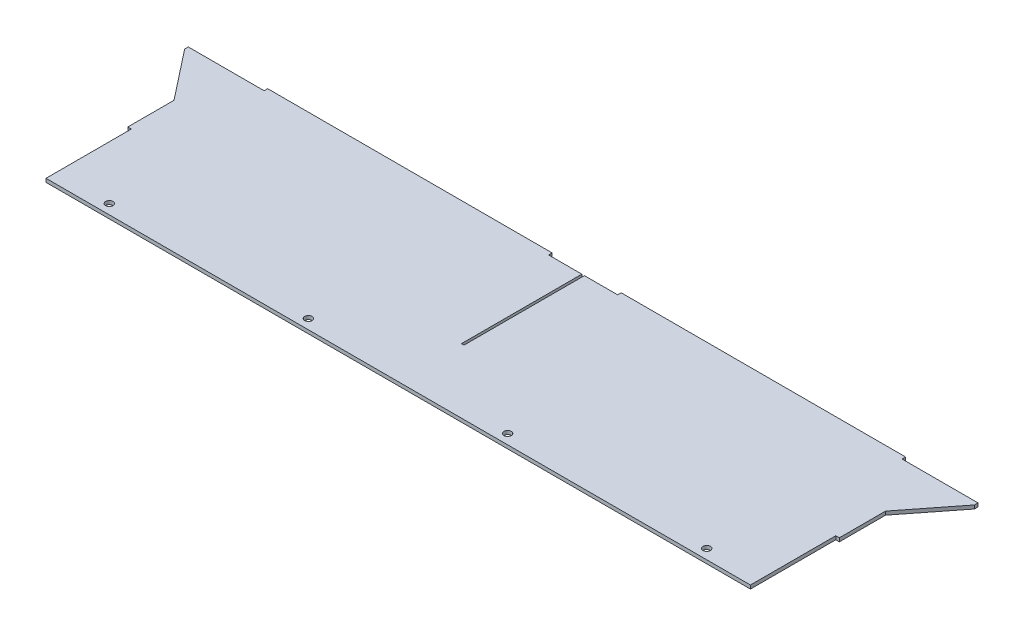
from build123d import *

# Parameters (mm, degrees)
SKETCH1_W            = 635.3556
SKETCH1_H            = 165.1
BOSS_EXTRUDE1_DEPTH  = 1.5875
SKETCH2_W            = 254
SKETCH2_H            = 3.175
BOSS_EXTRUDE2_DEPTH  = 3.175
BOSS_EXTRUDE3_DEPTH  = 3.175
SKETCH5_W            = 1.143
SKETCH5_H            = 107.442
SKETCH5_W_2          = 3.175
SKETCH5_H_2          = 76.2
CUT_EXTRUDE2_DEPTH   = 363.887848815
M6_CLEARANCE_HOLE1_D = 6.6
LPATTERN2_COUNT      = 4
LPATTERN2_PITCH      = 177.8


with BuildPart() as part:
    # Sketch1 → Boss-Extrude1 (new, symmetric)
    with BuildSketch(Plane(origin=(0, 0, 0), x_dir=(1, 0, 0), z_dir=(0, 1, 0))):
        Rectangle(SKETCH1_W, SKETCH1_H)
    extrude(amount=BOSS_EXTRUDE1_DEPTH, both=True)

    # Sketch2 → Boss-Extrude2 (add)
    with BuildSketch(Plane(origin=(0, 0, -82.55), x_dir=(-1, 0, 0), z_dir=(0, 0, -1))):
        with Locations((-157.8229, 0)):
            Rectangle(SKETCH2_W, SKETCH2_H)
        with Locations((157.8229, 0)):
            Rectangle(SKETCH2_W, SKETCH2_H)
    extrude(amount=BOSS_EXTRUDE2_DEPTH)

    # Sketch3 → Boss-Extrude3 (add)
    with BuildSketch(Plane.XZ.offset(1.5875)):
        Polygon((317.6778, -82.55), (352.6028, -82.55), (352.6028, -79.375), (317.6778, -34.925), align=None)
    boss_extrude3 = extrude(amount=-BOSS_EXTRUDE3_DEPTH)

    # Mirror1: Boss-Extrude3 across plane
    add(boss_extrude3.mirror(Plane(origin=(0, 0, 0), x_dir=(0, 0, 1), z_dir=(1, 0, 0))))

    # Sketch5 → Cut-Extrude2 (cut, through all)
    with BuildSketch(Plane.XZ.offset(1.5875)):
        with Locations((0.5715, -28.829)):
            Rectangle(SKETCH5_W, SKETCH5_H)
        with Locations((-0.5715, -28.829)):
            Rectangle(SKETCH5_W, SKETCH5_H)
        with Locations((-316.0903, 44.45)):
            Rectangle(SKETCH5_W_2, SKETCH5_H_2)
        with Locations((316.0903, 44.45)):
            Rectangle(SKETCH5_W_2, SKETCH5_H_2)
    extrude(amount=-CUT_EXTRUDE2_DEPTH, mode=Mode.SUBTRACT)

    # M6 Clearance Hole1 (through all)
    with Locations(Plane(origin=(0, 1.5875, 0), x_dir=(1, 0, 0), z_dir=(0, 1, 0))):
        with Locations((266.7, -73.8124)):
            m6_clearance_hole1 = Hole(M6_CLEARANCE_HOLE1_D / 2)

    # LPattern2: M6 Clearance Hole1 ×4
    with Locations(*[(-i * LPATTERN2_PITCH, 0, 0) for i in range(1, LPATTERN2_COUNT)]):
        add(m6_clearance_hole1, mode=Mode.SUBTRACT)


solid = part.part
